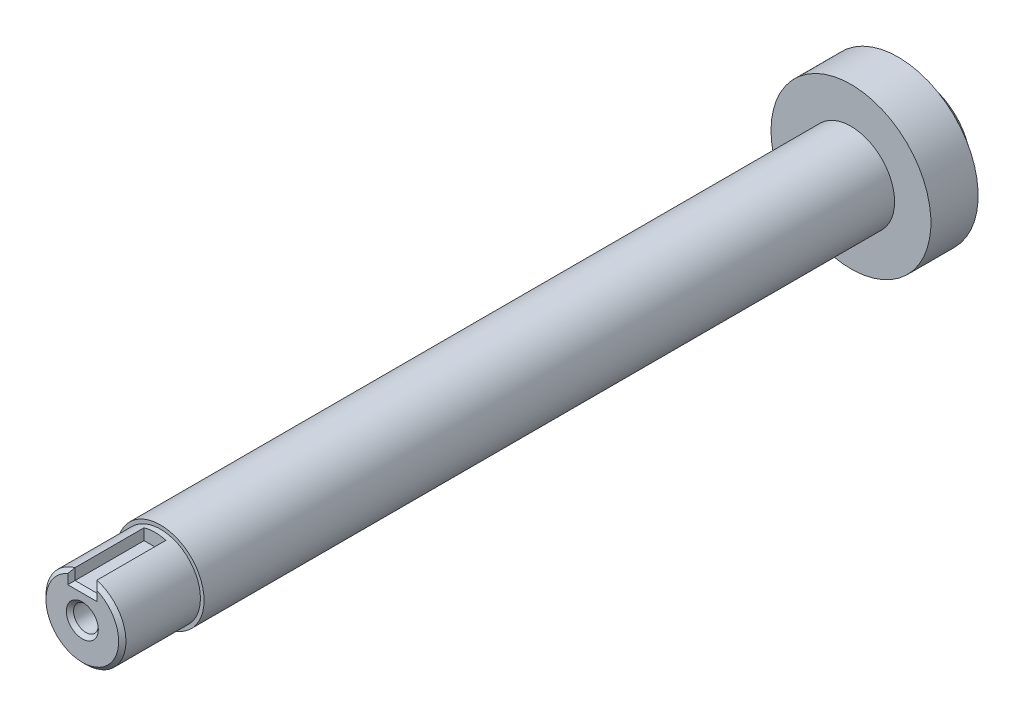
from build123d import *

# Parameters (mm, degrees)
SKETCH1_W                      = 22
SKETCH1_H                      = 13
SKETCH2_R                      = 12
BOSS_EXTRUDE1_DEPTH            = 190
SKETCH3_R                      = 11
BOSS_EXTRUDE2_DEPTH            = 21.5
CUT_EXTRUDE1_START             = -20
CUT_EXTRUDE1_DEPTH             = 20
SKETCH5_R                      = 15
BOSS_EXTRUDE3_DEPTH            = 6
F_6_8_6_8_DIAMETER_HOLE1_D     = 6.8
F_6_8_6_8_DIAMETER_HOLE1_DEPTH = 16
CHAMFER1_SIZE                  = 1


with BuildPart() as part:
    # Sketch1 → Revolve1 (revolve)
    with BuildSketch(Plane.XZ, mode=Mode.PRIVATE) as revolve1_sk:
        with Locations((11, 12.5)):
            Rectangle(SKETCH1_W, SKETCH1_H)
    revolve(revolve1_sk.sketch.rotate(Axis((0, 0, 19), (0, 0, -1)), 180), axis=Axis((0, 0, 19), (0, 0, -1)))

    # Sketch2 → Boss-Extrude1 (add)
    with BuildSketch(Plane.XY.offset(19)):
        Circle(SKETCH2_R)
    extrude(amount=BOSS_EXTRUDE1_DEPTH)

    # Sketch3 → Boss-Extrude2 (add)
    with BuildSketch(Plane.XY.offset(209)):
        Circle(SKETCH3_R)
    extrude(amount=BOSS_EXTRUDE2_DEPTH)

    # Sketch4 → Cut-Extrude1 (cut)
    with BuildSketch(Plane.XY.offset(230.5).offset(CUT_EXTRUDE1_START)):
        with BuildLine():
            Line((3, 7.5), (3, 10.583005244))
            ThreePointArc((3, 10.583005244), (0, 11), (-3, 10.583005244))
            Line((-3, 10.583005244), (-3, 7.5))
            Line((-3, 7.5), (3, 7.5))
        make_face()
    extrude(amount=CUT_EXTRUDE1_DEPTH, mode=Mode.SUBTRACT)

    # Sketch5 → Boss-Extrude3 (add)
    with BuildSketch(Plane(origin=(0, 0, 6), x_dir=(-1, 0, 0), z_dir=(0, 0, -1))):
        with Locations(Location((0, 0, 0), (0, 0, 90))):
            Circle(SKETCH5_R)
    extrude(amount=BOSS_EXTRUDE3_DEPTH)

    # Ø6.8 (6.8) Diameter Hole1
    with Locations(Plane.XY.offset(230.5)):
        with Locations((0, 0)):
            Hole(F_6_8_6_8_DIAMETER_HOLE1_D / 2, depth=F_6_8_6_8_DIAMETER_HOLE1_DEPTH)

    # Chamfer1
    chamfer1_edges = [part.edges().sort_by_distance(p)[0] for p in [
        (-6.633249581, -8.774964387, 230.5),
        (0, 7.5, 230.5),
        (3, 9.041502622, 230.5),
        (-3, 9.041502622, 230.5),
        (0, -15, 0),
        (3.4, 0, 230.5),
    ]]
    chamfer(chamfer1_edges, length=CHAMFER1_SIZE)


solid = part.part
